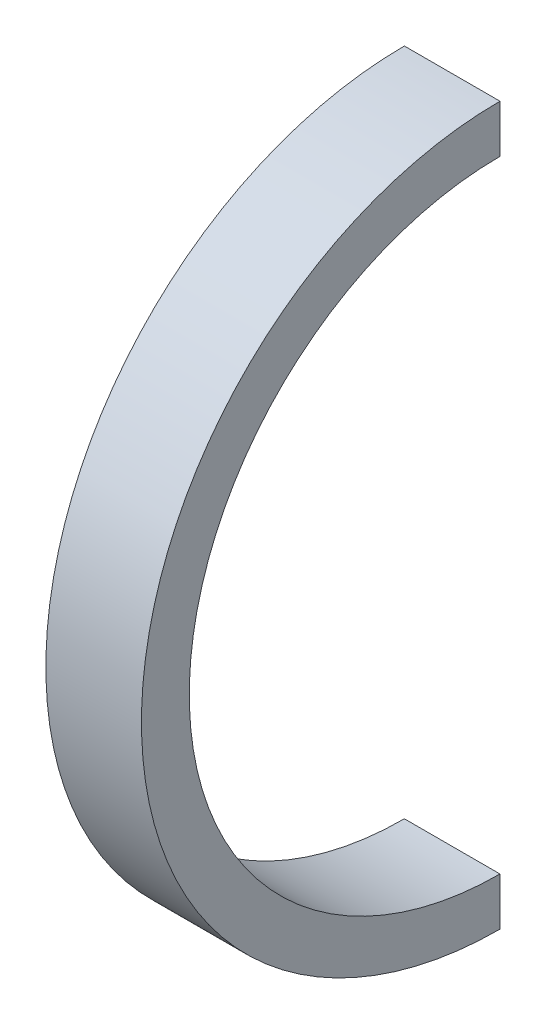
from build123d import *

# Parameters (mm, degrees)
SKETCH1_R           = 95.25
SKETCH1_R_2         = 82.55
BOSS_EXTRUDE1_DEPTH = 25.4
SKETCH2_W           = 95.25
SKETCH2_H           = 190.5
CUT_EXTRUDE1_DEPTH  = 25.4


with BuildPart() as part:
    # Sketch1 → Boss-Extrude1 (new body)
    with BuildSketch(Plane(origin=(0, 0, 0), x_dir=(0, 0, -1), z_dir=(1, 0, 0))):
        Circle(SKETCH1_R)
        Circle(SKETCH1_R_2, mode=Mode.SUBTRACT)
    extrude(amount=BOSS_EXTRUDE1_DEPTH)

    # Sketch2 → Cut-Extrude1 (cut)
    with BuildSketch(Plane.ZY):
        with Locations((-47.625, 0)):
            Rectangle(SKETCH2_W, SKETCH2_H)
    extrude(amount=-CUT_EXTRUDE1_DEPTH, mode=Mode.SUBTRACT)


solid = part.part
